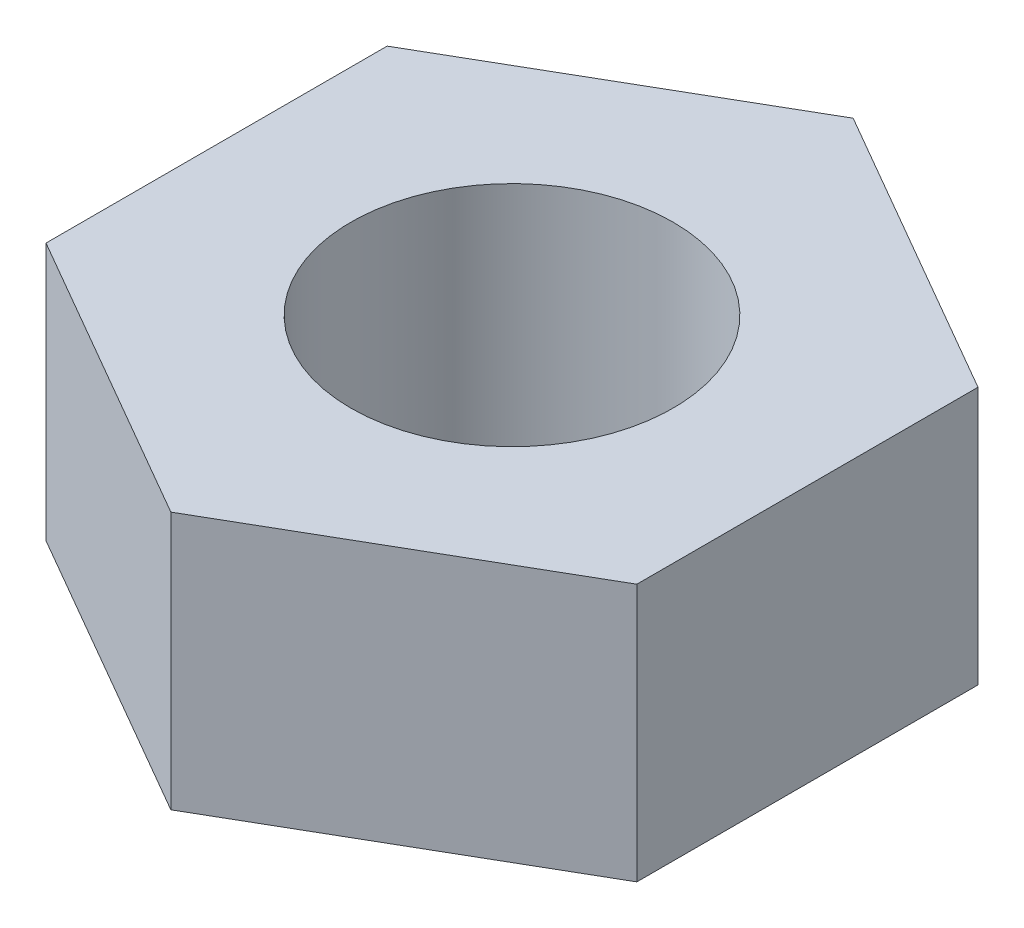
from build123d import *

# Parameters (mm, degrees)
SKETCH_1_R      = 1.5
EXTRUDE_1_DEPTH = 2.4


with BuildPart() as part:
    # 草图1 → 凸台-拉伸1 (new body)
    with BuildSketch(Plane(origin=(0, 0, 0), x_dir=(1, 0, 0), z_dir=(0, 1, 0))):
        Polygon((2.75, 1.58771324), (0, 3.175426481), (-2.75, 1.58771324), (-2.75, -1.58771324), (0, -3.175426481), (2.75, -1.58771324), align=None)
        with Locations(Location((0, 0, 0), (0, 0, 270))):
            Circle(SKETCH_1_R, mode=Mode.SUBTRACT)
    extrude(amount=EXTRUDE_1_DEPTH)


solid = part.part
